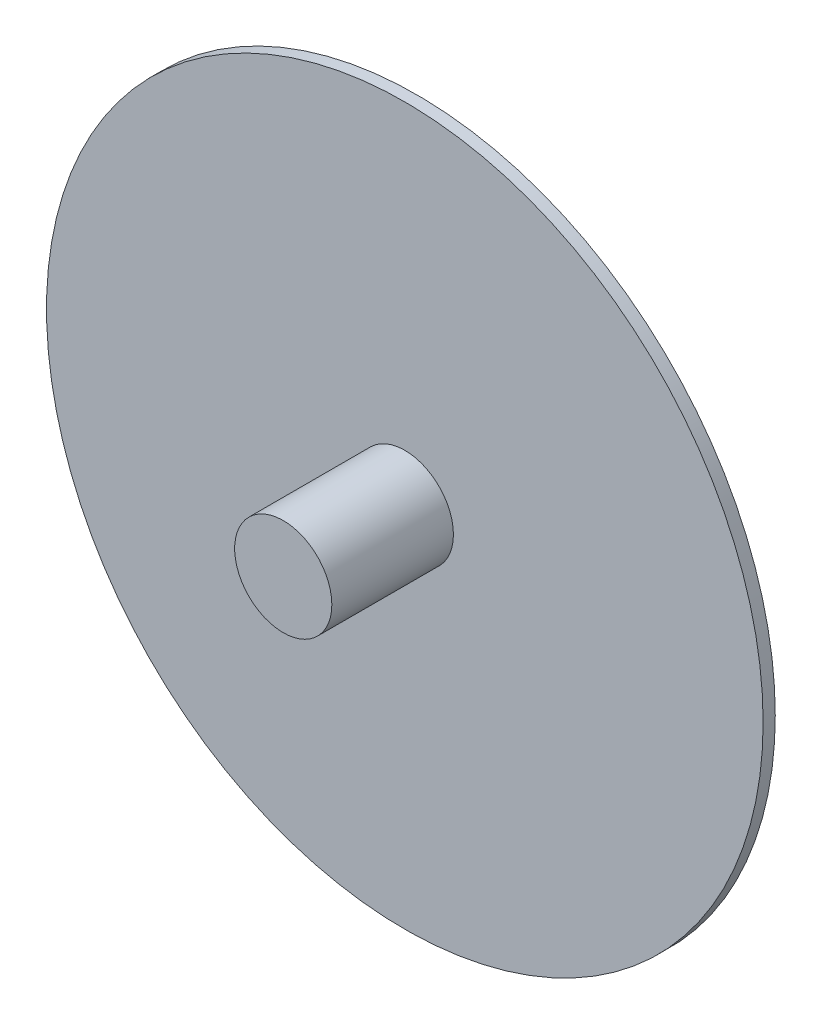
from build123d import *

# Parameters (mm, degrees)
SKETCH_1_R      = 29.5
EXTRUDE_2_DEPTH = 1
SKETCH_2_R      = 4
EXTRUDE_3_DEPTH = 10.01


with BuildPart() as part:
    # 草图1 → 凸台-拉伸2 (new body)
    with BuildSketch(Plane.XY):
        with Locations((0, -0.654398217)):
            Circle(SKETCH_1_R)
    extrude(amount=EXTRUDE_2_DEPTH)

    # 草图2 → 凸台-拉伸3 (add)
    with BuildSketch(Plane.XY.offset(1)):
        Circle(SKETCH_2_R)
    extrude(amount=EXTRUDE_3_DEPTH)


solid = part.part
